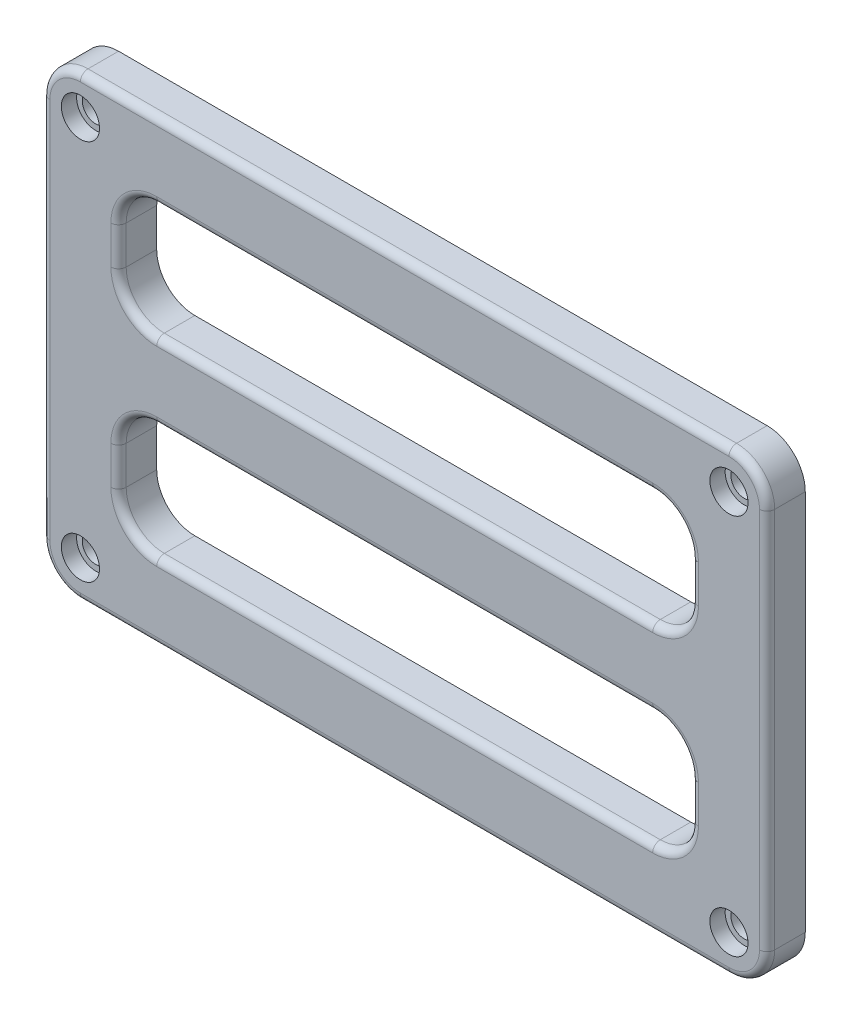
from build123d import *

# Parameters (mm, degrees)
SKETCH1_W           = 95
SKETCH1_H           = 60
SKETCH1_W_2         = 75
SKETCH1_H_2         = 40
BOSS_EXTRUDE1_DEPTH = 5
BOSS_EXTRUDE2_DEPTH = 5
SKETCH5_R           = 1.75
CUT_EXTRUDE2_DEPTH  = 99.742088291
SKETCH6_R           = 2.5
CUT_EXTRUDE3_DEPTH  = 2
FILLET1_R           = 5
FILLET2_R           = 1


with BuildPart() as part:
    # Sketch1 → Boss-Extrude1 (new body)
    with BuildSketch(Plane.XY):
        with Locations((37.5, 20)):
            Rectangle(SKETCH1_W, SKETCH1_H)
        with Locations((37.5, 20)):
            Rectangle(SKETCH1_W_2, SKETCH1_H_2, mode=Mode.SUBTRACT)
    extrude(amount=BOSS_EXTRUDE1_DEPTH)

    # Sketch2 → Boss-Extrude2 (add)
    with BuildSketch(Plane.XY.offset(5)):
        Polygon((0, 25), (75, 25), (75, 20), (75, 15), (0, 15), (0, 20), align=None)
    extrude(amount=-BOSS_EXTRUDE2_DEPTH)

    # Sketch5 → Cut-Extrude2 (cut, through all)
    with BuildSketch(Plane.XY.offset(5)):
        with Locations((-5, 45)):
            Circle(SKETCH5_R)
        with Locations((80, 45)):
            Circle(SKETCH5_R)
        with Locations((80, -5)):
            Circle(SKETCH5_R)
        with Locations((-5, -5)):
            Circle(SKETCH5_R)
    extrude(amount=-CUT_EXTRUDE2_DEPTH, mode=Mode.SUBTRACT)

    # Sketch6 → Cut-Extrude3 (cut)
    with BuildSketch(Plane.XY.offset(5)):
        with Locations((-5, 45)):
            Circle(SKETCH6_R)
        with Locations((80, 45)):
            Circle(SKETCH6_R)
        with Locations((80, -5)):
            Circle(SKETCH6_R)
        with Locations((-5, -5)):
            Circle(SKETCH6_R)
    extrude(amount=-CUT_EXTRUDE3_DEPTH, mode=Mode.SUBTRACT)

    # Fillet1
    fillet1_edges = [part.edges().sort_by_distance(p)[0] for p in [
        (0, 40, 2.5),
        (0, 0, 2.5),
        (75, 0, 2.5),
        (75, 40, 2.5),
        (0, 15, 2.5),
        (0, 25, 2.5),
        (75, 25, 2.5),
        (75, 15, 2.5),
        (-10, 50, 2.5),
        (85, 50, 2.5),
        (85, -10, 2.5),
        (-10, -10, 2.5),
    ]]
    fillet(fillet1_edges, radius=FILLET1_R)

    # Fillet2
    fillet2_edges = [part.edges().sort_by_distance(p)[0] for p in [
        (0, 7.5, 5),
        (37.5, 15, 5),
        (37.5, 0, 5),
        (75, 7.5, 5),
        (37.5, 25, 5),
        (0, 32.5, 5),
        (75, 32.5, 5),
        (37.5, 40, 5),
        (-10, 20, 5),
        (37.5, 50, 5),
        (37.5, -10, 5),
        (85, 20, 5),
        (-8.535533906, -8.535533906, 5),
        (83.535533906, -8.535533906, 5),
        (83.535533906, 48.535533906, 5),
        (-8.535533906, 48.535533906, 5),
        (1.464466094, 13.535533906, 5),
        (73.535533906, 1.464466094, 5),
        (73.535533906, 13.535533906, 5),
        (1.464466094, 1.464466094, 5),
        (1.464466094, 26.464466094, 5),
        (73.535533906, 26.464466094, 5),
        (73.535533906, 38.535533906, 5),
        (1.464466094, 38.535533906, 5),
    ]]
    fillet(fillet2_edges, radius=FILLET2_R)


solid = part.part
